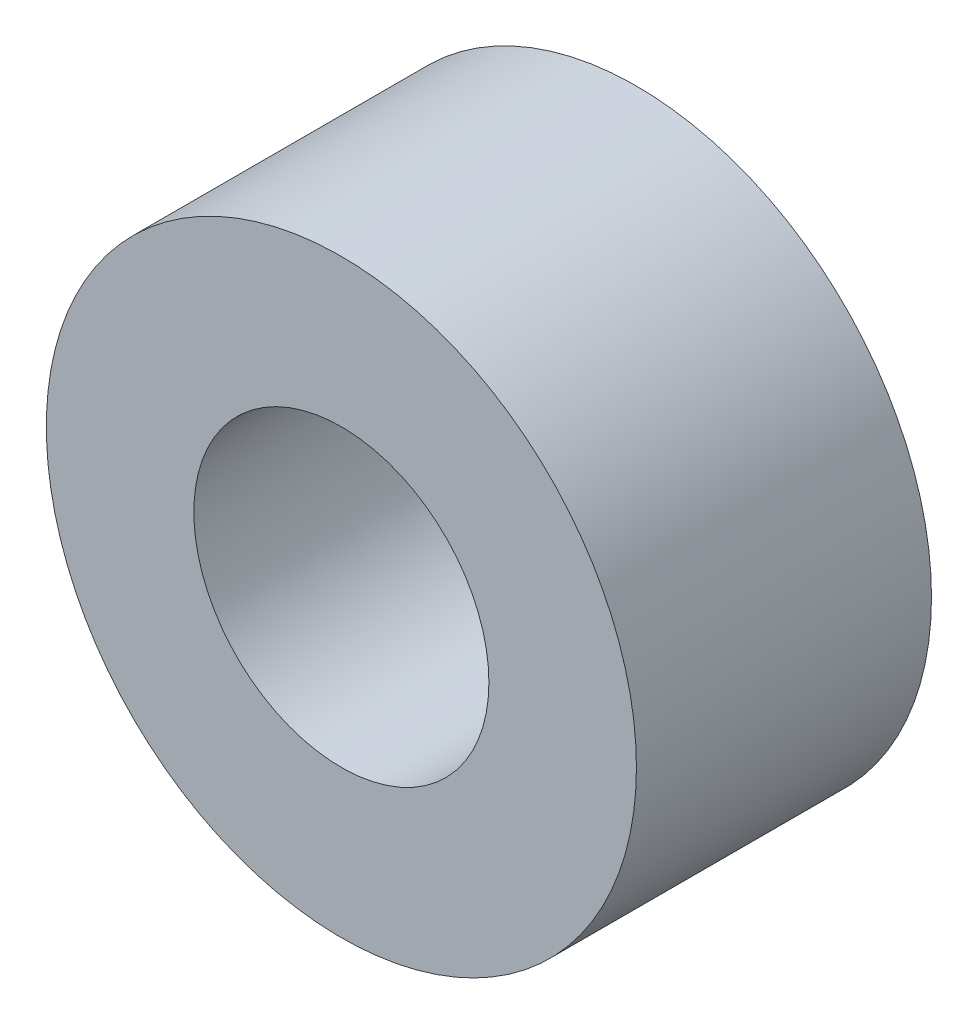
from build123d import *

# Parameters (mm, degrees)
ESQUISSE1_R             = 10
BASE_EXTRUSION_DEPTH    = 10
ESQUISSE2_R             = 5
ENL_V_MAT_EXTRU_1_DEPTH = 10


with BuildPart() as part:
    # Esquisse1 → Base-Extrusion (new body)
    with BuildSketch(Plane.XY):
        Circle(ESQUISSE1_R)
    extrude(amount=BASE_EXTRUSION_DEPTH)

    # Esquisse2 → Enlèv. mat.-Extru.1 (cut)
    with BuildSketch(Plane.XY.offset(10)):
        Circle(ESQUISSE2_R)
    extrude(amount=-ENL_V_MAT_EXTRU_1_DEPTH, mode=Mode.SUBTRACT)


solid = part.part
